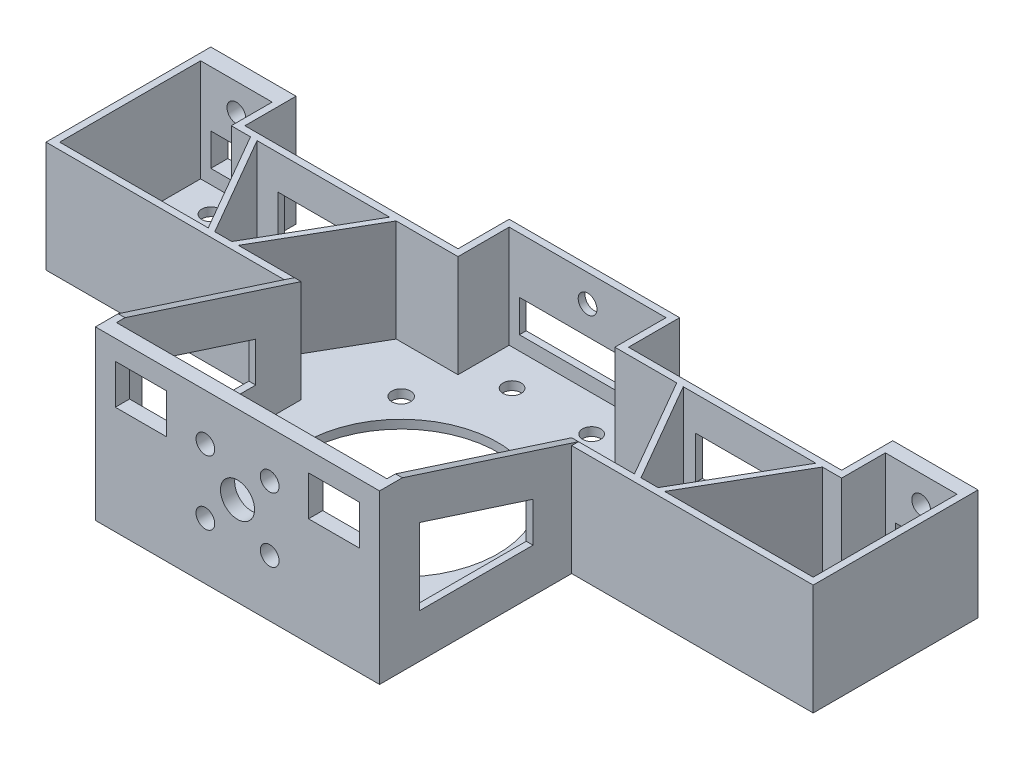
from build123d import *

# Parameters (mm, degrees)
SKETCH_2_R           = 1.6
SKETCH_2_R_2         = 17
SKETCH_2_R_3         = 1.65
EXTRUDE_2_DEPTH      = 1.5
EXTRUDE_3_DEPTH      = 18
EXTRUDE_4_DEPTH      = 10
CUT_EXTRUDE_5_DEPTH  = 116.63018637
SKETCH_10_R          = 3
SKETCH_10_R_2        = 1.65
SKETCH_10_W          = 9
SKETCH_10_H          = 7
CUT_EXTRUDE_4_DEPTH  = 5
EXTRUDE_5_DEPTH      = 18
SKETCH_14_R          = 1.65
CUT_EXTRUDE_6_DEPTH  = 10
CUT_EXTRUDE_7_DEPTH  = 116.63018637
SKETCH_18_W          = 9
SKETCH_18_H          = 5.7
SKETCH_18_W_2        = 24
CUT_EXTRUDE_8_DEPTH  = 10
CUT_EXTRUDE_9_DEPTH  = 10
SKETCH_21_W          = 17.5
SKETCH_21_H          = 7.5
CUT_EXTRUDE_10_DEPTH = 1.2


with BuildPart() as part:
    # 草图2 → 凸台-拉伸2 (new body)
    with BuildSketch(Plane(origin=(0, 0, 0), x_dir=(1, 0, 0), z_dir=(0, 1, 0))):
        Polygon((-42.5, 33.8), (-42.5, 62.8), (-27.5, 62.8), (-27.5, 53.8), (10, 53.8), (10, 62.8), (40, 62.8), (40, 53.8), (77.5, 53.8), (77.5, 62.8), (92.5, 62.8), (92.5, 33.8), (50, 33.8), (50, 0), (0, 0), (0, 33.8), align=None)
        with Locations(Location((-35, 55.312210178, 0), (0, 0, 270))):
            Circle(SKETCH_2_R, mode=Mode.SUBTRACT)
        with Locations(Location((85, 55.312210178, 0), (0, 0, 270))):
            Circle(SKETCH_2_R, mode=Mode.SUBTRACT)
        with Locations(Location((18, 55.312210178, 0), (0, 0, 270))):
            Circle(SKETCH_2_R, mode=Mode.SUBTRACT)
        with Locations(Location((32, 55.312210178, 0), (0, 0, 270))):
            Circle(SKETCH_2_R, mode=Mode.SUBTRACT)
        with Locations(Location((25, 28.8, 0), (0, 0, 270))):
            Circle(SKETCH_2_R_2, mode=Mode.SUBTRACT)
        with Locations(Location((40.5, 44.3, 0), (0, 0, 270))):
            Circle(SKETCH_2_R_3, mode=Mode.SUBTRACT)
        with Locations(Location((40.5, 13.3, 0), (0, 0, 270))):
            Circle(SKETCH_2_R_3, mode=Mode.SUBTRACT)
        with Locations(Location((9.5, 13.3, 0), (0, 0, 270))):
            Circle(SKETCH_2_R_3, mode=Mode.SUBTRACT)
        with Locations(Location((9.5, 44.3, 0), (0, 0, 270))):
            Circle(SKETCH_2_R_3, mode=Mode.SUBTRACT)
    extrude(amount=EXTRUDE_2_DEPTH)

    # 草图6 → 凸台-拉伸3 (add)
    with BuildSketch(Plane(origin=(0, 1.5, 0), x_dir=(1, 0, 0), z_dir=(0, 1, 0))):
        Polygon((10, 53.8), (-27.5, 53.8), (-27.5, 62.8), (-42.5, 62.8), (-42.5, 33.8), (0, 33.8), (0, 0), (50, 0), (50, 33.8), (92.5, 33.8), (92.5, 62.8), (77.5, 62.8), (77.5, 53.8), (40, 53.8), (40, 62.8), (10, 62.8), align=None)
        Polygon((11.2, 52.6), (-28.7, 52.6), (-28.7, 59.8), (-41.3, 59.8), (-41.3, 35), (1.2, 35), (1.2, 2.5), (48.8, 2.5), (48.8, 35), (91.3, 35), (91.3, 60.3), (78.7, 60.3), (78.7, 52.6), (38.8, 52.6), (38.8, 61.6), (11.2, 61.6), align=None, mode=Mode.SUBTRACT)
    extrude(amount=EXTRUDE_3_DEPTH)

    # 草图11 → 凸台-拉伸4 (add)
    with BuildSketch(Plane(origin=(0, 19.5, 0), x_dir=(1, 0, 0), z_dir=(0, 1, 0))):
        Polygon((1.2, 35), (1.2, 2.5), (48.8, 2.5), (48.8, 35), (50, 35), (50, 0), (0, 0), (0, 35), align=None)
    extrude(amount=EXTRUDE_4_DEPTH)

    # 草图12 → 切除-拉伸5 (cut, through all)
    with BuildSketch(Plane.ZY):
        Polygon((-35, 19.5), (-4, 29.5), (-35, 29.5), align=None)
    extrude(amount=-CUT_EXTRUDE_5_DEPTH, mode=Mode.SUBTRACT)

    # 草图10 → 切除-拉伸4 (cut)
    with BuildSketch(Plane.XY):
        with Locations((25, 15.656854249)):
            Circle(SKETCH_10_R)
        with Locations((30.656854249, 21.313708499)):
            Circle(SKETCH_10_R_2)
        with Locations((30.656854249, 10)):
            Circle(SKETCH_10_R_2)
        with Locations((19.343145751, 10)):
            Circle(SKETCH_10_R_2)
        with Locations((19.343145751, 21.313708499)):
            Circle(SKETCH_10_R_2)
        with Locations((8, 22.5)):
            Rectangle(SKETCH_10_W, SKETCH_10_H)
        with Locations((42, 22.5)):
            Rectangle(SKETCH_10_W, SKETCH_10_H)
    extrude(amount=-CUT_EXTRUDE_4_DEPTH, mode=Mode.SUBTRACT)

    # 草图13 → 凸台-拉伸5 (add)
    with BuildSketch(Plane(origin=(0, 1.5, 0), x_dir=(1, 0, 0), z_dir=(0, 1, 0))):
        Polygon((0.316065276, 52.6), (-0.838635262, 52.6), (-11, 35), (-9.845299462, 35), align=None)
        Polygon((-15.154700538, 35), (-14, 35), (-24.161364738, 52.6), (-25.316065276, 52.6), align=None)
        Polygon((59.845299462, 35), (61, 35), (50.838635262, 52.6), (49.683934724, 52.6), align=None)
        Polygon((75.316065276, 52.6), (74.161364738, 52.6), (64, 35), (65.154700538, 35), align=None)
    extrude(amount=EXTRUDE_5_DEPTH)

    # 草图14 → 切除-拉伸6 (cut)
    with BuildSketch(Plane(origin=(0, 0, -62.8), x_dir=(-1, 0, 0), z_dir=(0, 0, -1))):
        with Locations((35, 14.7)):
            Circle(SKETCH_14_R)
        with Locations(Location((-85, 14.7, 0), (0, 0, 180))):
            Circle(SKETCH_14_R)
        with Locations((-25, 14.7)):
            Circle(SKETCH_14_R)
    extrude(amount=-CUT_EXTRUDE_6_DEPTH, mode=Mode.SUBTRACT)

    # 草图17 → 切除-拉伸7 (cut, through all)
    with BuildSketch(Plane.ZY):
        Polygon((-7, 21.177065656), (-27, 14.725452753), (-27, 7.725452753), (-7, 7.725452753), align=None)
    extrude(amount=-CUT_EXTRUDE_7_DEPTH, mode=Mode.SUBTRACT)

    # 草图18 → 切除-拉伸8 (cut)
    with BuildSketch(Plane(origin=(0, 0, -62.8), x_dir=(-1, 0, 0), z_dir=(0, 0, -1))):
        with Locations((-85, 6.85)):
            Rectangle(SKETCH_18_W, SKETCH_18_H)
        with Locations((-25, 6.85)):
            Rectangle(SKETCH_18_W_2, SKETCH_18_H)
        with Locations((35, 6.85)):
            Rectangle(SKETCH_18_W, SKETCH_18_H)
    extrude(amount=-CUT_EXTRUDE_8_DEPTH, mode=Mode.SUBTRACT)

    # 草图20 → 切除-拉伸9 (cut)
    with BuildSketch(Plane(origin=(0, 1.5, 0), x_dir=(1, 0, 0), z_dir=(0, 1, 0))):
        Polygon((-12.5, 40.401923789), (-7.766838493, 48.6), (-17.233161507, 48.6), align=None)
        Polygon((62.5, 40.401923789), (67.233161507, 48.6), (57.766838493, 48.6), align=None)
        Polygon((-36.3, 50.373953839), (-33.7, 50.373953839), (-33.7, 47.6), (-28.202816622, 47.6), (-23.814954576, 40), (-36.3, 40), align=None)
        Polygon((86.3, 40), (73.814954576, 40), (78.202816622, 47.6), (83.7, 47.6), (83.7, 50.373953839), (86.3, 50.373953839), align=None)
    extrude(amount=-CUT_EXTRUDE_9_DEPTH, mode=Mode.SUBTRACT)

    # 草图21 → 切除-拉伸10 (cut)
    with BuildSketch(Plane(origin=(0, 0, -53.8), x_dir=(-1, 0, 0), z_dir=(0, 0, -1))):
        with Locations((11.75, 9.75)):
            Rectangle(SKETCH_21_W, SKETCH_21_H)
        with Locations((-61.75, 9.75)):
            Rectangle(SKETCH_21_W, SKETCH_21_H)
    extrude(amount=-CUT_EXTRUDE_10_DEPTH, mode=Mode.SUBTRACT)


solid = part.part
